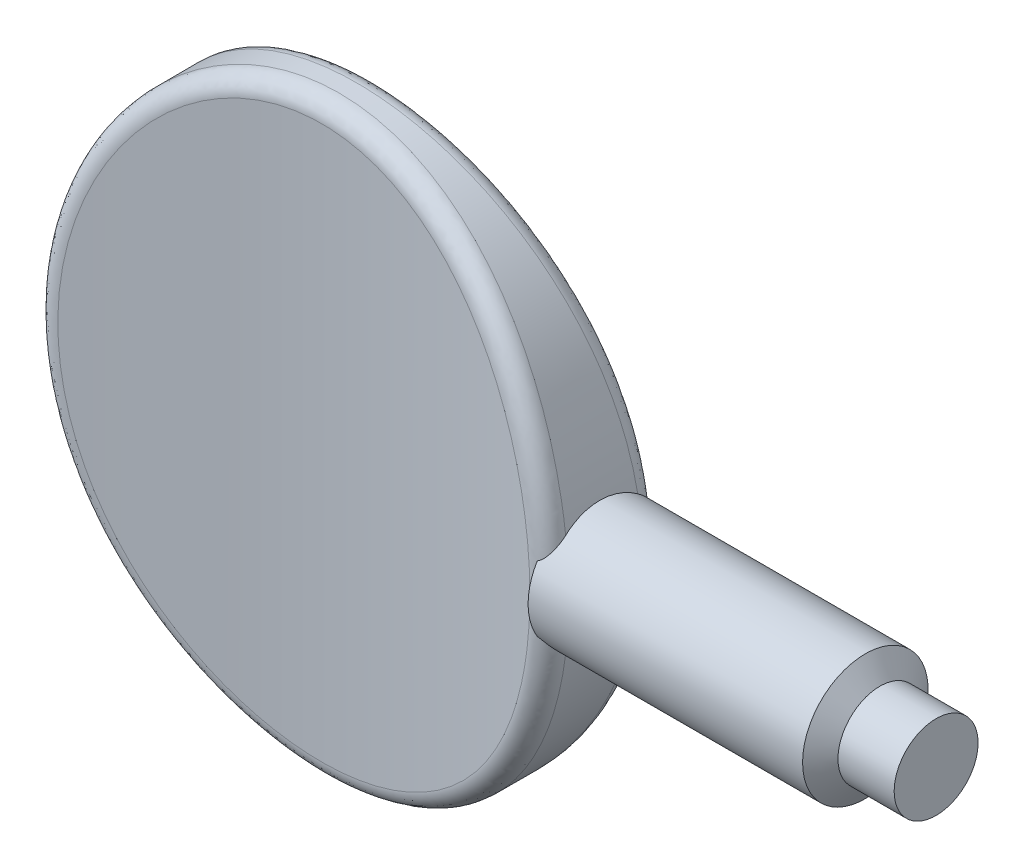
from build123d import *

# Parameters (mm, degrees)
SKETCH1_RX              = 11.303
SKETCH1_RY              = 9.906
EXTRUDE1_DEPTH          = 2.286
CUT_EXTRUDE1_DEPTH      = 16.202382741
CUT_EXTRUDE1_DEPTH_BACK = 16.202382741
SKETCH2_OUTSIDE_W       = 27.892
SKETCH2_OUTSIDE_H       = 12.652
FILLET3_R               = 0.677333333


with BuildPart() as part:
    # Sketch1 → Extrude1 (new, symmetric)
    with BuildSketch(Plane.XY):
        with Locations(Location((0, 0), (0, 0, -90))):
            Ellipse(SKETCH1_RX, SKETCH1_RY)
    extrude(amount=EXTRUDE1_DEPTH, both=True)

    # Sketch2 outside → Cut-Extrude1 (cut, two sides: drawn at the far end of the back side and taken through both)
    with BuildSketch(Plane(origin=(0, 0, 0), x_dir=(1, 0, 0), z_dir=(0, 1, 0)).offset(-CUT_EXTRUDE1_DEPTH_BACK)):
        Rectangle(SKETCH2_OUTSIDE_W, SKETCH2_OUTSIDE_H)
        with BuildLine():
            Line((-9.906, 2.286), (-9.906, -2.286))
            ThreePointArc((-9.906, -2.286), (0, -1.016), (9.906, -2.286))
            Line((9.906, -2.286), (9.906, 2.286))
            ThreePointArc((9.906, 2.286), (0, 1.016), (-9.906, 2.286))
        make_face(mode=Mode.SUBTRACT)
    extrude(amount=CUT_EXTRUDE1_DEPTH + CUT_EXTRUDE1_DEPTH_BACK, mode=Mode.SUBTRACT)

    # Fillet3
    fillet3_edges = [part.edges().sort_by_distance(p)[0] for p in [
        (-7.228513924, -7.728494619, 1.687044844),
        (3.75e-07, 11.303, -1.016),
    ]]
    fillet(fillet3_edges, radius=FILLET3_R)

    # Sketch3 → Revolve1 (revolve)
    with BuildSketch(Plane(origin=(0, 0, 0), x_dir=(1, 0, 0), z_dir=(0, 1, 0))):
        with BuildLine():
            Line((22.606, 0), (22.606, 1.6129))
            Line((22.606, 1.6129), (20.447, 1.6129))
            Line((20.447, 1.6129), (19.886763949, 2.413))
            Line((19.886763949, 2.413), (13.208, 2.413))
            Line((13.208, 2.413), (9.336678517, 2.413))
            ThreePointArc((9.336678517, 2.413), (9.262571156, 2.199720149), (9.072182281, 2.078343579))
            Line((9.072182281, 2.078343579), (9.072182281, 0))
            Line((9.072182281, 0), (22.606, 0))
        make_face()
    revolve(axis=Axis((0, 0, 0), (1, 0, 0)))


solid = part.part
